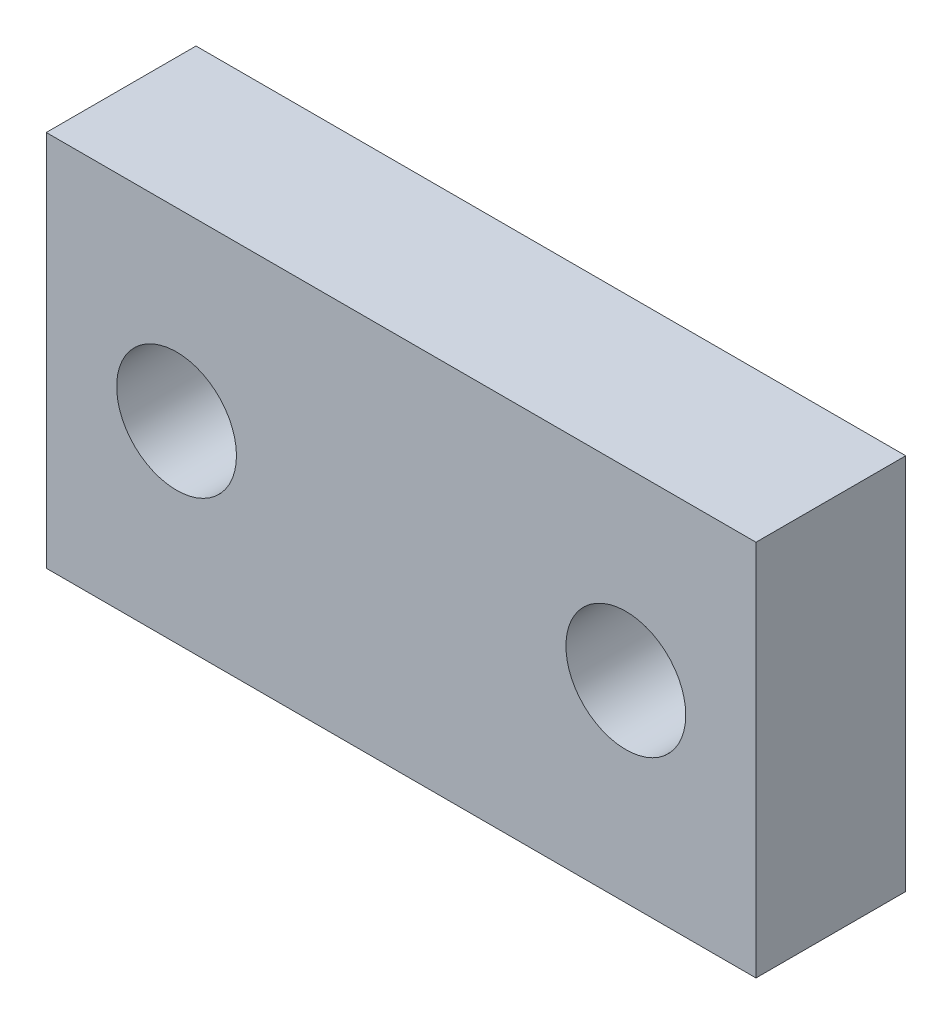
from build123d import *

# Parameters (mm, degrees)
ESQUISSE1_W        = 23.695260015
ESQUISSE1_H        = 12.6
ESQUISSE1_R        = 2
BOSS_EXTRU_1_DEPTH = 5


with BuildPart() as part:
    # Esquisse1 → Boss.-Extru.1 (new body)
    with BuildSketch(Plane.XY):
        with Locations((-5.99209908, 12.295954438)):
            Rectangle(ESQUISSE1_W, ESQUISSE1_H)
        with Locations((-13.489729087, 12.425985115)):
            Circle(ESQUISSE1_R, mode=Mode.SUBTRACT)
        with Locations((1.510270913, 12.425985115)):
            Circle(ESQUISSE1_R, mode=Mode.SUBTRACT)
    extrude(amount=BOSS_EXTRU_1_DEPTH)


solid = part.part
